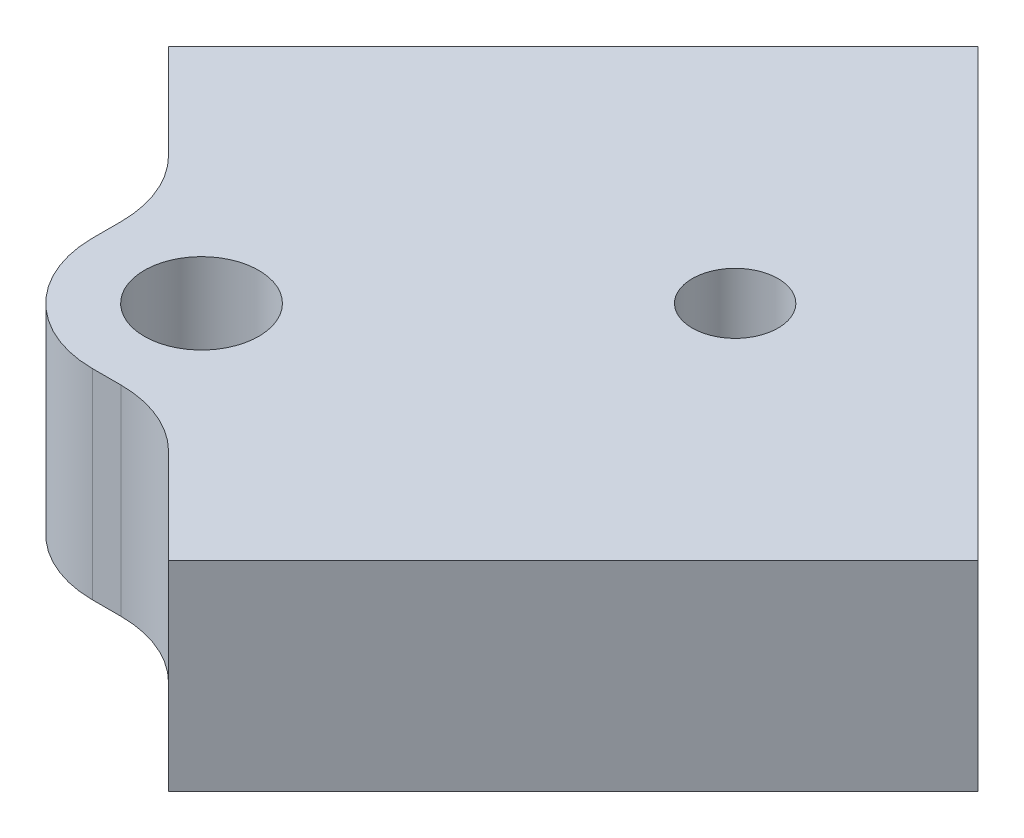
from build123d import *

# Parameters (mm, degrees)
AUFSATZ_LINEAR_AUSTRAGEN1_DEPTH = 7
F_4_0_4_DURCHMESSER_BOHRUNG1_D  = 4
F_3_0_3_DURCHMESSER_BOHRUNG1_D  = 3


with BuildPart() as part:
    # Skizze1 → Aufsatz-Linear austragen1 (new body)
    with BuildSketch(Plane(origin=(0, 0, 0), x_dir=(1, 0, 0), z_dir=(0, 1, 0))):
        with BuildLine():
            Line((0, -3.95), (1, -3.95))
            ThreePointArc((1, -3.95), (2.530733729, -4.25448187), (3.828427125, -5.121572875))
            Line((3.828427125, -5.121572875), (7.131601718, -8.424747468))
            Line((7.131601718, -8.424747468), (21.273737342, 5.717388155))
            Line((21.273737342, 5.717388155), (5.717388155, 21.273737342))
            Line((5.717388155, 21.273737342), (-8.424747468, 7.131601718))
            Line((-8.424747468, 7.131601718), (-5.121572875, 3.828427125))
            ThreePointArc((-5.121572875, 3.828427125), (-4.25448187, 2.530733729), (-3.95, 1))
            Line((-3.95, 1), (-3.95, 0))
            ThreePointArc((-3.95, 0), (-2.793071786, -2.793071786), (0, -3.95))
        make_face()
    extrude(amount=AUFSATZ_LINEAR_AUSTRAGEN1_DEPTH)

    # Ø4.0 (4) Durchmesser Bohrung1 (through all)
    with Locations(Plane(origin=(0, 7, 0), x_dir=(1, 0, 0), z_dir=(0, 1, 0))):
        with Locations((-0.070710678, -0.070710678)):
            Hole(F_4_0_4_DURCHMESSER_BOHRUNG1_D / 2)

    # Ø3.0 (3) Durchmesser Bohrung1 (through all)
    with Locations(Plane(origin=(0, 7, 0), x_dir=(1, 0, 0), z_dir=(0, 1, 0))):
        with Locations((9.252922061, 9.252922061)):
            Hole(F_3_0_3_DURCHMESSER_BOHRUNG1_D / 2)


solid = part.part
